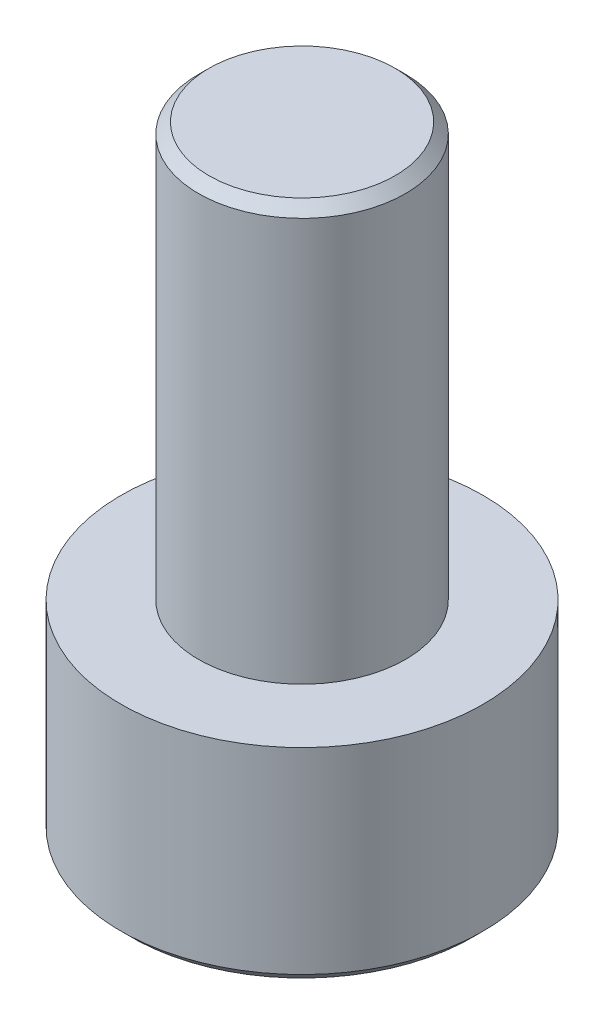
from build123d import *

# Parameters (mm, degrees)
SIMPLIFIED_START                    = -4
SIMPLIFIED_NOMINAL_HEX_SOCKET_DEPTH = 2


with BuildPart() as part:
    # Reconstructed nominal axial profile → Native revolved geometry (revolve)
    with BuildSketch(Plane.XY, mode=Mode.PRIVATE) as native_revolved_geometry_sk:
        Polygon((0, -4), (3.3, -4), (3.5, -3.8), (3.5, 0), (2, 0), (2, 7.8), (1.8, 8), (0, 8), align=None)
    revolve(native_revolved_geometry_sk.sketch.rotate(Axis((0, -500, 0), (0, 1, 0)), 90), axis=Axis((0, -500, 0), (0, 1, 0)))

    # Sketch2 → Simplified nominal hex socket (cut)
    with BuildSketch(Plane(origin=(0, 0, 0), x_dir=(1, 0, 0), z_dir=(0, 1, 0)).offset(SIMPLIFIED_START)):
        Polygon((1.732050808, 0), (0.866025404, -1.5), (-0.866025404, -1.5), (-1.732050808, 0), (-0.866025404, 1.5), (0.866025404, 1.5), align=None)
    extrude(amount=SIMPLIFIED_NOMINAL_HEX_SOCKET_DEPTH, mode=Mode.SUBTRACT)


solid = part.part
